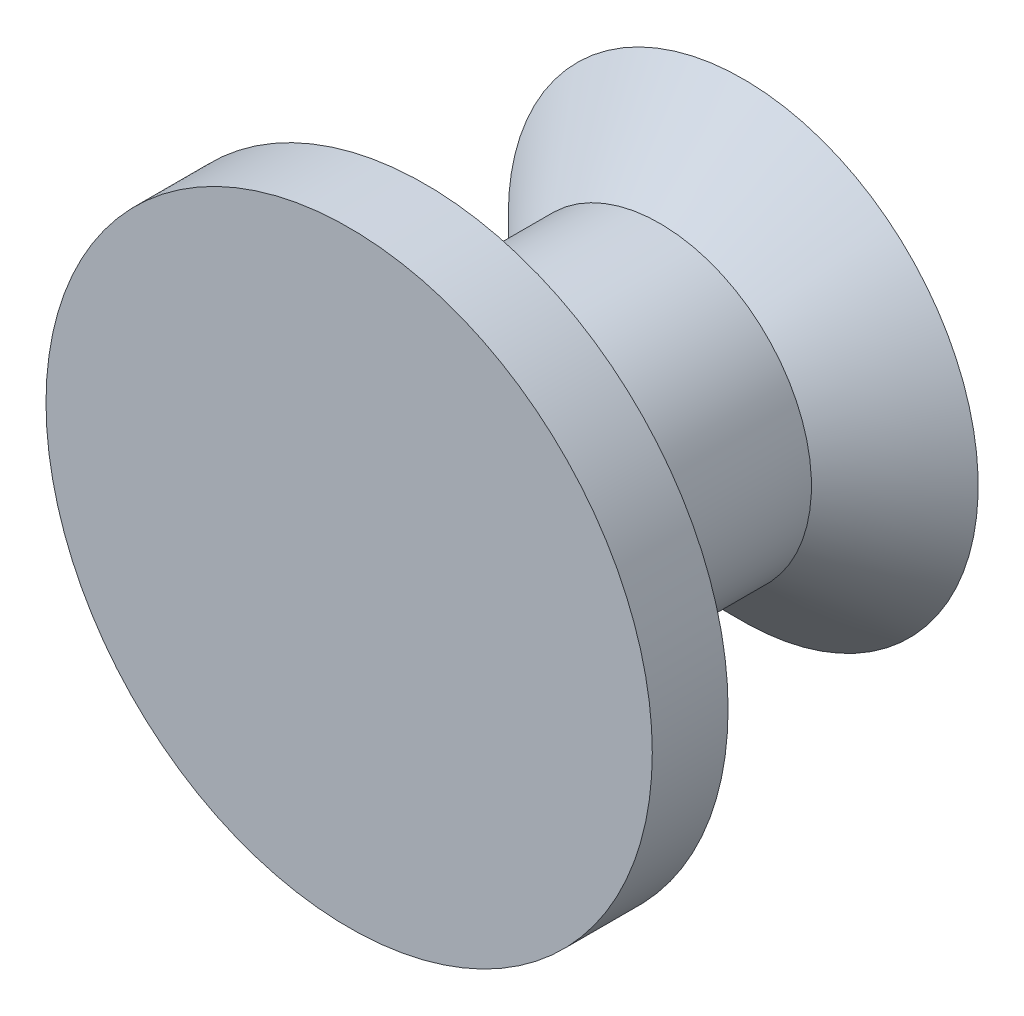
from build123d import *


with BuildPart() as part:
    # Sketch2 → Revolve1 (revolve)
    with BuildSketch(Plane(origin=(0, 0, 0), x_dir=(1, 0, 0), z_dir=(0, 1, 0))):
        Polygon((0, 0), (-2, 0), (-2, 0.5), (-1, 0.5), (-1, 2.05), (-1.55, 2.6), (0, 2.6), align=None)
    revolve(axis=Axis((0, 0, -2.6), (0, 0, 1)))


solid = part.part
